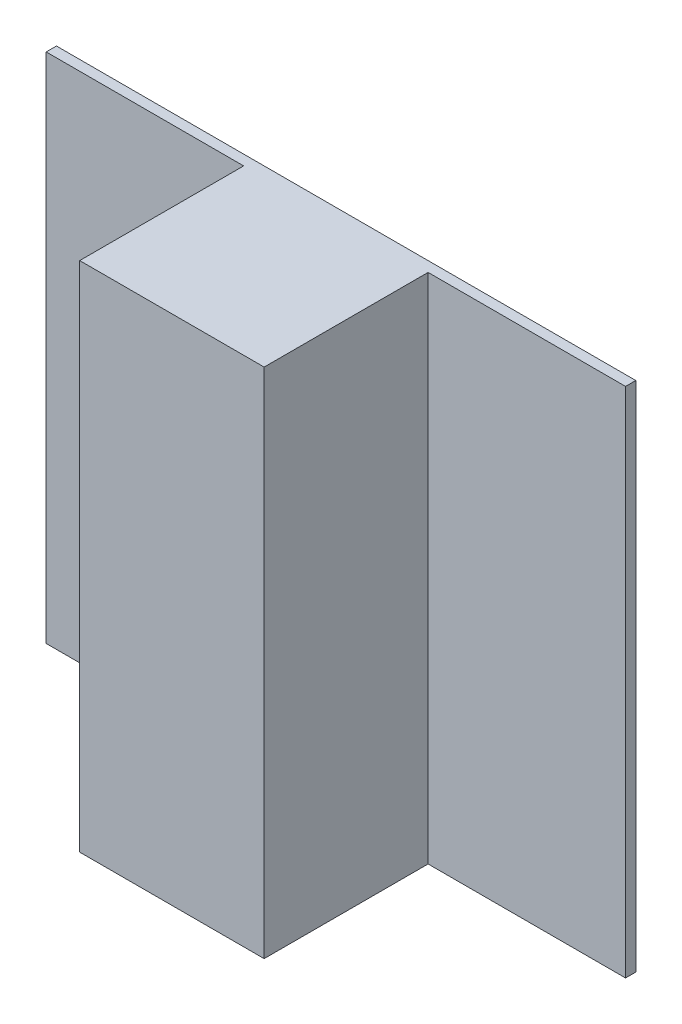
from build123d import *

# Parameters (mm, degrees)
ESQUISSE1_W        = 90
ESQUISSE1_H        = 250
BOSS_EXTRU_1_DEPTH = 5
ESQUISSE2_W        = 90
ESQUISSE2_H        = 250
ESQUISSE2_W_2      = 80
ESQUISSE2_H_2      = 240
BOSS_EXTRU_2_DEPTH = 75
BOSS_EXTRU_3_DEPTH = 5


with BuildPart() as part:
    # Esquisse1 → Boss.-Extru.1 (new body)
    with BuildSketch(Plane.XY):
        with Locations((-45, 125)):
            Rectangle(ESQUISSE1_W, ESQUISSE1_H)
    extrude(amount=BOSS_EXTRU_1_DEPTH)

    # Esquisse2 → Boss.-Extru.2 (add)
    with BuildSketch(Plane(origin=(0, 0, 0), x_dir=(-1, 0, 0), z_dir=(0, 0, -1))):
        with Locations((45, 125)):
            Rectangle(ESQUISSE2_W, ESQUISSE2_H)
        with Locations((45, 125)):
            Rectangle(ESQUISSE2_W_2, ESQUISSE2_H_2, mode=Mode.SUBTRACT)
    extrude(amount=BOSS_EXTRU_2_DEPTH)

    # Esquisse3 → Boss.-Extru.3 (add)
    with BuildSketch(Plane(origin=(0, 0, -75), x_dir=(-1, 0, 0), z_dir=(0, 0, -1))):
        Polygon((6.025463364, 250), (-96.347652867, 250), (-96.347652867, 0), (-31.347652867, 0), (45, 0), (45, 5), (5, 5), (5, 245), (45, 245), (45, 250), align=None)
    boss_extru_3 = extrude(amount=BOSS_EXTRU_3_DEPTH)

    # Symétrie1: Boss.-Extru.3 across plane
    add(boss_extru_3.mirror(Plane(origin=(-45, 245, -80), x_dir=(0, 0, 1), z_dir=(1, 0, 0))))


solid = part.part
